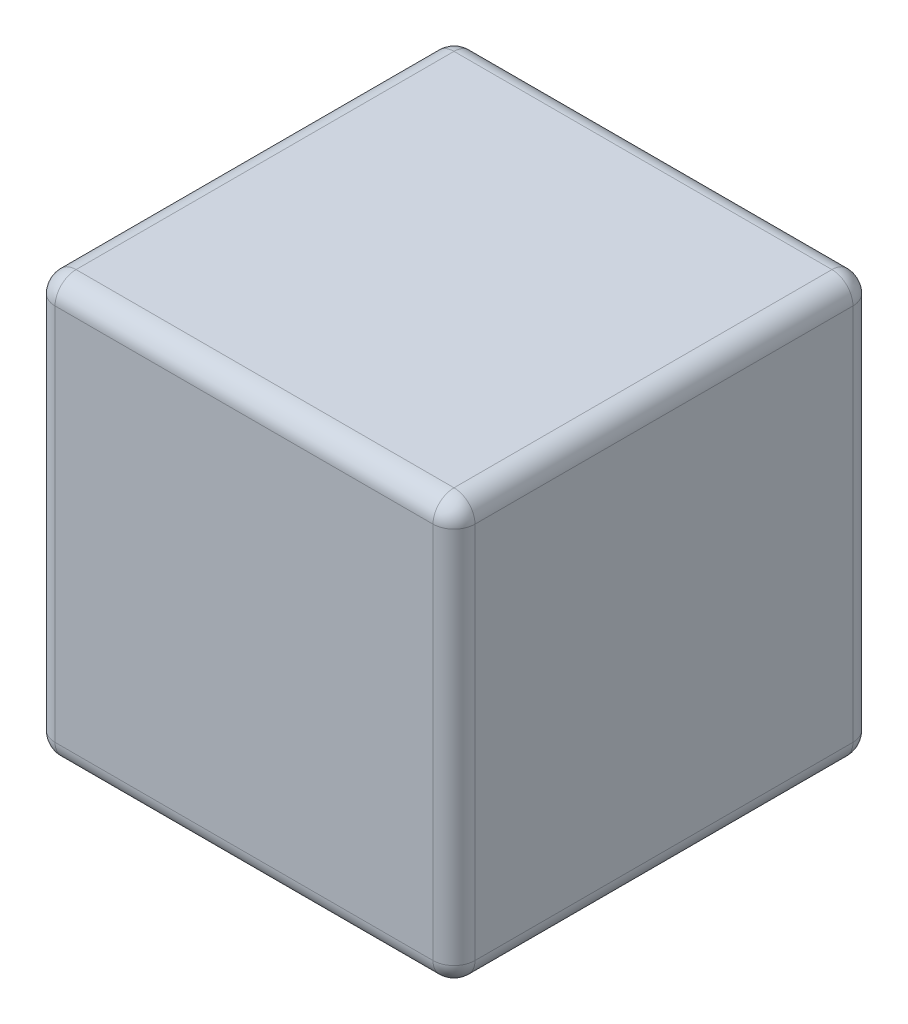
from build123d import *

# Parameters (mm, degrees)
SKETCH1_W           = 100
SKETCH1_H           = 100
BOSS_EXTRUDE1_DEPTH = 100
SKETCH3_R           = 10
CUT_EXTRUDE1_DEPTH  = 10
SKETCH4_R           = 10
CUT_EXTRUDE2_DEPTH  = 10
FILLET5_R           = 5


with BuildPart() as part:
    # Sketch1 → Boss-Extrude1 (new body)
    with BuildSketch(Plane(origin=(0, 0, 0), x_dir=(1, 0, 0), z_dir=(0, 1, 0))):
        with Locations((50, 50)):
            Rectangle(SKETCH1_W, SKETCH1_H)
    extrude(amount=BOSS_EXTRUDE1_DEPTH)

    # Sketch3 → Cut-Extrude1 (cut)
    with BuildSketch(Plane(origin=(0, 0, -100), x_dir=(-1, 0, 0), z_dir=(0, 0, -1))):
        with Locations((-50, 50)):
            Circle(SKETCH3_R)
    extrude(amount=-CUT_EXTRUDE1_DEPTH, mode=Mode.SUBTRACT)

    # Sketch4 → Cut-Extrude2 (cut)
    with BuildSketch(Plane.XZ):
        with Locations(Location((21.715728753, -78.284271247, 0), (0, 0, 270))):
            Circle(SKETCH4_R)
        with Locations(Location((21.715728753, -21.715728753, 0), (0, 0, 270))):
            Circle(SKETCH4_R)
        with Locations(Location((78.284271247, -78.284271247, 0), (0, 0, 270))):
            Circle(SKETCH4_R)
        with Locations(Location((78.284271247, -21.715728753, 0), (0, 0, 270))):
            Circle(SKETCH4_R)
        with Locations(Location((50, -50, 0), (0, 0, 270))):
            Circle(SKETCH4_R)
    extrude(amount=-CUT_EXTRUDE2_DEPTH, mode=Mode.SUBTRACT)

    # Fillet5
    fillet5_edges = [part.edges().sort_by_distance(p)[0] for p in [
        (100, 100, -50),
        (50, 100, -100),
        (0, 100, -50),
        (50, 0, -100),
        (100, 0, -50),
        (50, 0, 0),
        (0, 0, -50),
        (0, 50, -100),
        (100, 50, -100),
        (100, 50, 0),
        (0, 50, 0),
        (50, 100, 0),
    ]]
    fillet(fillet5_edges, radius=FILLET5_R)


solid = part.part
